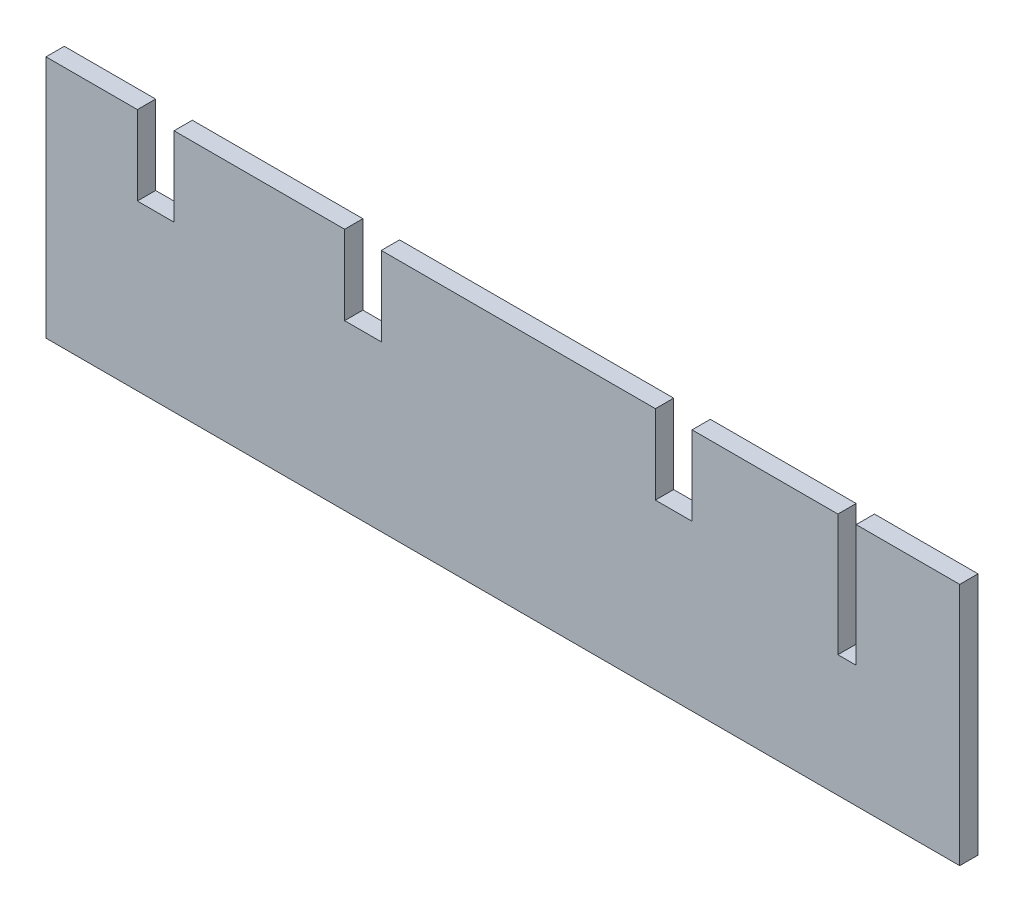
from build123d import *

# Parameters (mm, degrees)
BOSS_EXTRUDE1_DEPTH = 6
SKETCH2_W           = 6
SKETCH2_H           = 40
CUT_EXTRUDE1_DEPTH  = 10


with BuildPart() as part:
    # Sketch1 → Boss-Extrude1 (new body)
    with BuildSketch(Plane.XY):
        Polygon((-350, 40), (-350, 14), (-337.96, 14), (-337.96, 40), (-281.96, 40), (-281.96, 14), (-269.92, 14), (-269.92, 40), (-179.92, 40), (-179.92, 14), (-167.88, 14), (-167.88, 40), (-80, 40), (-80, -40), (-380, -40), (-380, 40), align=None)
    extrude(amount=BOSS_EXTRUDE1_DEPTH)

    # Sketch2 → Cut-Extrude1 (cut)
    with BuildSketch(Plane(origin=(0, 0, 0), x_dir=(-1, 0, 0), z_dir=(0, 0, -1))):
        with Locations((57, 20)):
            Rectangle(SKETCH2_W, SKETCH2_H)
        with Locations((117, 20)):
            Rectangle(SKETCH2_W, SKETCH2_H)
    extrude(amount=-CUT_EXTRUDE1_DEPTH, mode=Mode.SUBTRACT)


solid = part.part
